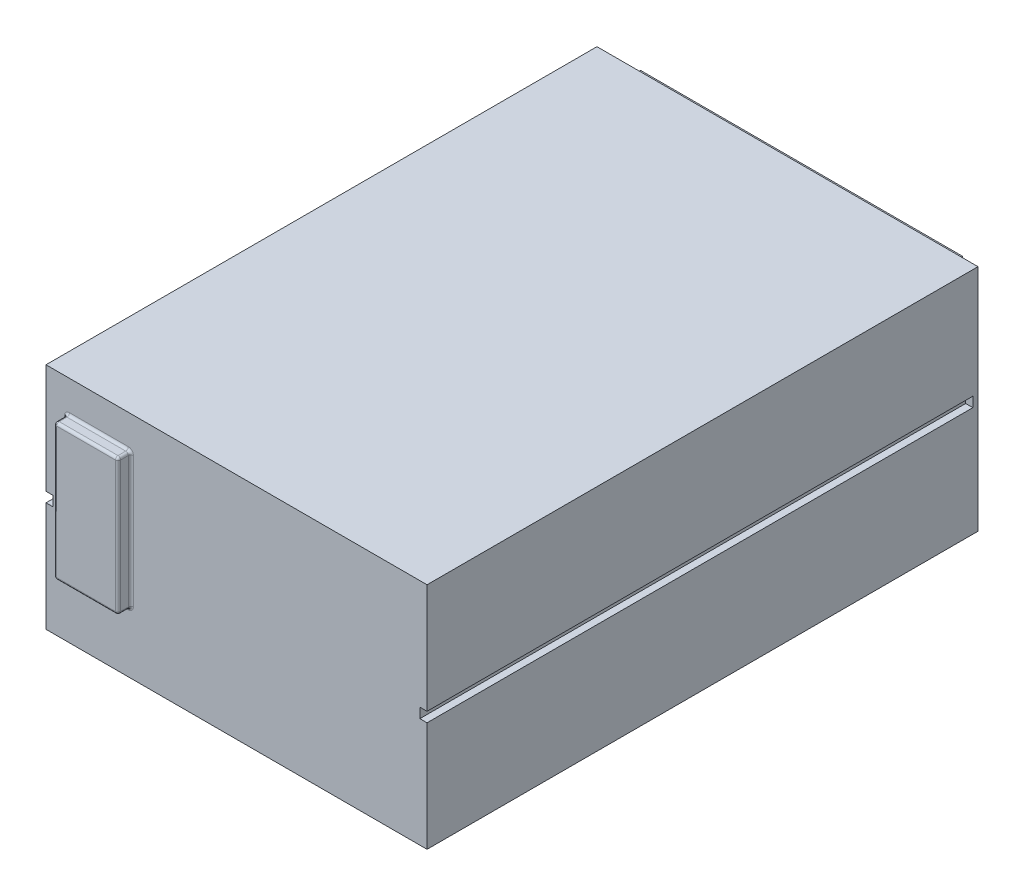
from build123d import *

# Parameters (mm, degrees)
SKETCH1_W           = 148
SKETCH1_H           = 214
BOSS_EXTRUDE1_DEPTH = 89
SKETCH2_W           = 5.566237362
SKETCH2_H           = 3.86389192
CUT_EXTRUDE1_DEPTH  = 212
SKETCH3_W           = 24.825910207
SKETCH3_H           = 52.918387546
BOSS_EXTRUDE2_DEPTH = 5
FILLET1_R           = 1
SKETCH4_W           = 125
SKETCH4_H           = 29
BOSS_EXTRUDE3_DEPTH = 1
LPATTERN1_COUNT     = 3
LPATTERN1_PITCH     = 29.5


with BuildPart() as part:
    # Sketch1 → Boss-Extrude1 (new body)
    with BuildSketch(Plane(origin=(0, 0, 0), x_dir=(1, 0, 0), z_dir=(0, 1, 0))):
        Rectangle(SKETCH1_W, SKETCH1_H)
    extrude(amount=BOSS_EXTRUDE1_DEPTH)

    # Sketch2 → Cut-Extrude1 (cut)
    with BuildSketch(Plane.XY.offset(107)):
        with Locations((-74, 44.5)):
            Rectangle(SKETCH2_W, SKETCH2_H)
    cut_extrude1 = extrude(amount=-CUT_EXTRUDE1_DEPTH, mode=Mode.SUBTRACT)

    # Mirror1: Cut-Extrude1 across plane
    add(cut_extrude1.mirror(Plane(origin=(0, 0, 0), x_dir=(0, 0, 1), z_dir=(1, 0, 0))), mode=Mode.SUBTRACT)

    # Sketch3 → Boss-Extrude2 (add)
    with BuildSketch(Plane.XY.offset(107)):
        with Locations((-53.45043607, 49.977386193)):
            Rectangle(SKETCH3_W, SKETCH3_H)
    extrude(amount=BOSS_EXTRUDE2_DEPTH)

    # Fillet1
    fillet1_edges = [part.edges().sort_by_distance(p)[0] for p in [
        (-41.037480966, 49.977386193, 107),
        (-41.037480966, 23.51819242, 109.5),
        (-53.450436069, 76.436579966, 107),
        (-41.037480966, 76.436579966, 109.5),
        (-65.863391173, 49.977386193, 107),
        (-65.863391173, 76.436579966, 109.5),
        (-53.450436069, 23.51819242, 107),
        (-65.863391173, 23.51819242, 109.5),
        (-41.037480966, 49.977386193, 112),
        (-53.450436069, 76.436579966, 112),
        (-65.863391173, 49.977386193, 112),
        (-53.450436069, 23.51819242, 112),
    ]]
    fillet(fillet1_edges, radius=FILLET1_R)

    # Sketch4 → Boss-Extrude3 (add)
    with BuildSketch(Plane(origin=(0, 0, -107), x_dir=(-1, 0, 0), z_dir=(0, 0, -1))):
        with Locations((-4.420464609, 74)):
            Rectangle(SKETCH4_W, SKETCH4_H)
    boss_extrude3 = extrude(amount=BOSS_EXTRUDE3_DEPTH)

    # LPattern1: Boss-Extrude3 ×3
    with Locations(*[(0, -i * LPATTERN1_PITCH, 0) for i in range(1, LPATTERN1_COUNT)]):
        add(boss_extrude3)


solid = part.part
